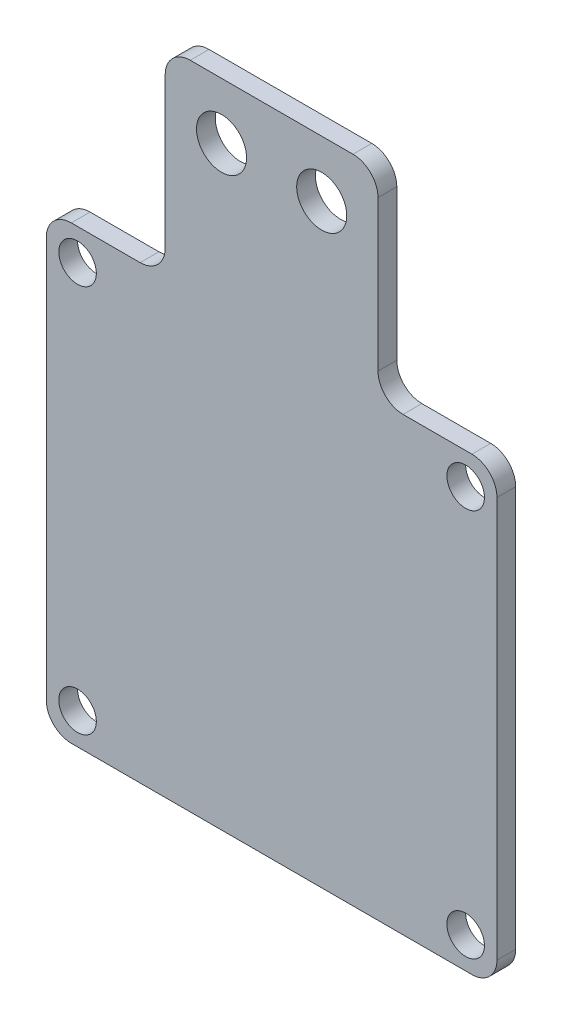
from build123d import *

# Parameters (mm, degrees)
CROQUIS1_R              = 1.5
CROQUIS1_R_2            = 2
SALIENTE_EXTRUIR1_DEPTH = 1.5


with BuildPart() as part:
    # Croquis1 → Saliente-Extruir1 (new body)
    with BuildSketch(Plane.XY):
        with BuildLine():
            Line((0, 0), (-16, 0))
            ThreePointArc((-16, 0), (-17.414213562, 0.585786438), (-18, 2))
            Line((-18, 2), (-18, 34))
            ThreePointArc((-18, 34), (-17.414213562, 35.414213562), (-16, 36))
            Line((-16, 36), (-10.5, 36))
            ThreePointArc((-10.5, 36), (-9.085786438, 36.585786438), (-8.5, 38))
            Line((-8.5, 38), (-8.5, 50))
            ThreePointArc((-8.5, 50), (-7.914213562, 51.414213562), (-6.5, 52))
            Line((-6.5, 52), (0, 52))
            Line((0, 52), (6.5, 52))
            ThreePointArc((6.5, 52), (7.914213562, 51.414213562), (8.5, 50))
            Line((8.5, 50), (8.5, 38))
            ThreePointArc((8.5, 38), (9.085786438, 36.585786438), (10.5, 36))
            Line((10.5, 36), (16, 36))
            ThreePointArc((16, 36), (17.414213562, 35.414213562), (18, 34))
            Line((18, 34), (18, 2))
            ThreePointArc((18, 2), (17.414213562, 0.585786438), (16, 0))
            Line((16, 0), (0, 0))
        make_face()
        with Locations((-15.5, 2.5)):
            Circle(CROQUIS1_R, mode=Mode.SUBTRACT)
        with Locations((-15.5, 33.5)):
            Circle(CROQUIS1_R, mode=Mode.SUBTRACT)
        with Locations((-4, 47.5)):
            Circle(CROQUIS1_R_2, mode=Mode.SUBTRACT)
        with Locations(Location((4, 47.5, 0), (0, 0, 180))):
            Circle(CROQUIS1_R_2, mode=Mode.SUBTRACT)
        with Locations(Location((15.5, 33.5, 0), (0, 0, 180))):
            Circle(CROQUIS1_R, mode=Mode.SUBTRACT)
        with Locations(Location((15.5, 2.5, 0), (0, 0, 180))):
            Circle(CROQUIS1_R, mode=Mode.SUBTRACT)
    extrude(amount=SALIENTE_EXTRUIR1_DEPTH)


solid = part.part
